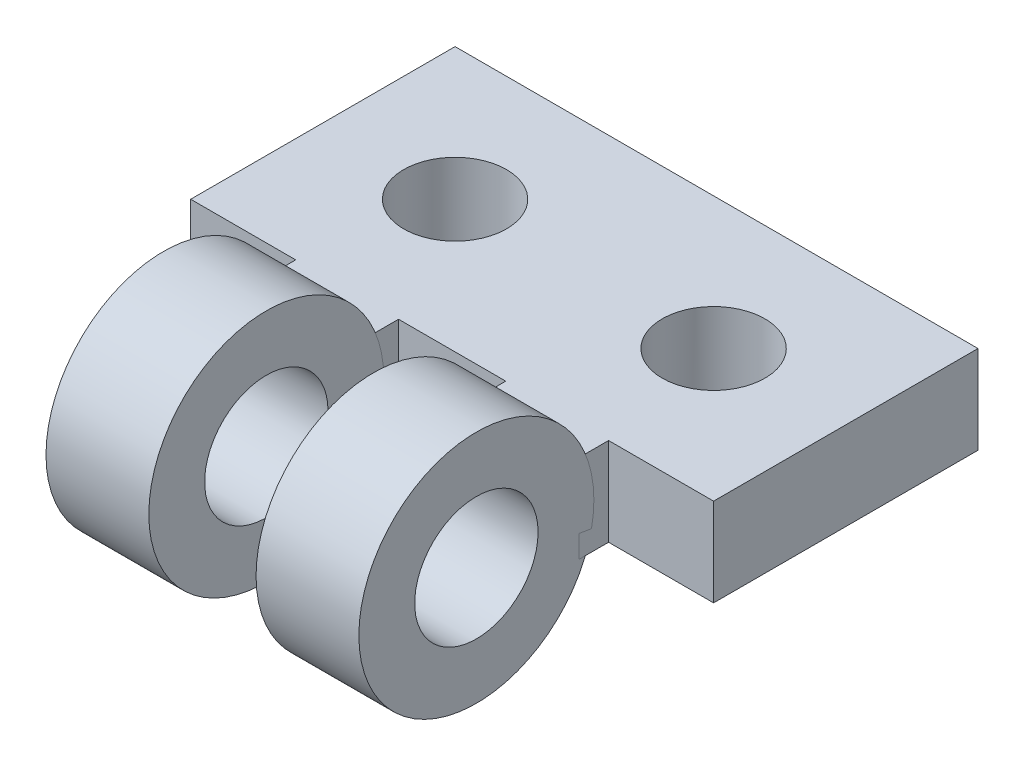
from build123d import *

# Parameters (mm, degrees)
CROQUIS1_R              = 4
CROQUIS1_R_2            = 2.1
SALIENTE_EXTRUIR1_DEPTH = 3.5
MATRIZL3_COUNT          = 2
MATRIZL3_PITCH          = 7.15
CROQUIS4_W              = 17.8
CROQUIS4_H              = 3
SALIENTE_EXTRUIR2_DEPTH = 10
CROQUIS5_R              = 1.75
CORTAR_EXTRUIR1_DEPTH   = 19.097669049
CROQUIS6_W              = 8.996759429
CROQUIS6_H              = 9.40282288
CORTAR_EXTRUIR2_DEPTH   = 21.015009993
CROQUIS7_W              = 9.055283223
CROQUIS7_H              = 9.327912758
CORTAR_EXTRUIR3_DEPTH   = 3.65


with BuildPart() as part:
    # Croquis1 → Saliente-Extruir1 (new body)
    with BuildSketch(Plane(origin=(0, 0, 0), x_dir=(0, -1, 0), z_dir=(1, 0, 0))):
        with Locations(Location((0, 0, 0), (0, 0, 90))):
            Circle(CROQUIS1_R)
        with Locations(Location((0, 0, 0), (0, 0, 90))):
            Circle(CROQUIS1_R_2, mode=Mode.SUBTRACT)
    extrude(amount=SALIENTE_EXTRUIR1_DEPTH)


with BuildPart() as matrizl3_1:
    # MatrizL3: pattern copy
    add(part.part.moved(Location(Vector(-1, 0, 0) * (1 * MATRIZL3_PITCH))))


with BuildPart() as body_3:
    # Croquis4 → Saliente-Extruir2 (new body)
    with BuildSketch(Plane.XY.offset(-3.5)):
        with Locations((-1.825, 0)):
            Rectangle(CROQUIS4_W, CROQUIS4_H)
    extrude(amount=-SALIENTE_EXTRUIR2_DEPTH)

    # Croquis5 → Cortar-Extruir1 (cut, through all)
    with BuildSketch(Plane(origin=(0, 1.5, 0), x_dir=(1, 0, 0), z_dir=(0, 1, 0))):
        with Locations(Location((2.575, 9, 0), (0, 0, 270))):
            Circle(CROQUIS5_R)
        with Locations(Location((-6.225, 9, 0), (0, 0, 90))):
            Circle(CROQUIS5_R)
    extrude(amount=-CORTAR_EXTRUIR1_DEPTH, mode=Mode.SUBTRACT)

    # Croquis6 → Cortar-Extruir2 (cut, through all)
    with BuildSketch(Plane(origin=(3.5, 0, 0), x_dir=(0, 0, -1), z_dir=(1, 0, 0))):
        with Locations((0.001620286, 0)):
            Rectangle(CROQUIS6_W, CROQUIS6_H)
    cortar_extruir2 = extrude(amount=CORTAR_EXTRUIR2_DEPTH, mode=Mode.SUBTRACT)

    # Croquis7 → Cortar-Extruir3 (cut)
    with BuildSketch(Plane.ZY):
        with Locations((0.027641611, 0)):
            Rectangle(CROQUIS7_W, CROQUIS7_H)
    extrude(amount=CORTAR_EXTRUIR3_DEPTH, mode=Mode.SUBTRACT)

    # Simetría1: Cortar-Extruir2 across plane
    add(cortar_extruir2.mirror(Plane(origin=(-1.825, 0, 0), x_dir=(0, 0, 1), z_dir=(1, 0, 0))), mode=Mode.SUBTRACT)


solid = Compound([part.part, matrizl3_1.part, body_3.part])
